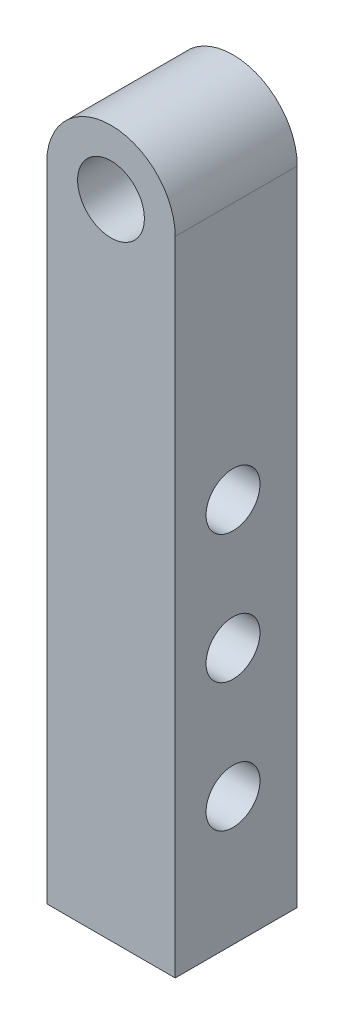
from build123d import *

# Parameters (mm, degrees)
SKETCH_1_R          = 2.6
EXTRUDE_1_DEPTH     = 9.5
SKETCH_2_R          = 2.1
CUT_EXTRUDE_1_DEPTH = 10


with BuildPart() as part:
    # 草图1 → 凸台-拉伸1 (new body)
    with BuildSketch(Plane.XY):
        with BuildLine():
            Line((-5, 0), (-5, -50))
            Line((-5, -50), (5, -50))
            Line((5, -50), (5, 0))
            ThreePointArc((5, 0), (0, 5), (-5, 0))
        make_face()
        Circle(SKETCH_1_R, mode=Mode.SUBTRACT)
    extrude(amount=EXTRUDE_1_DEPTH)

    # 草图2 → 切除-拉伸1 (cut)
    with BuildSketch(Plane.ZY.offset(5)):
        with Locations(Location((5, -20, 0), (0, 0, 270))):
            Circle(SKETCH_2_R)
        with Locations(Location((5, -30, 0), (0, 0, 270))):
            Circle(SKETCH_2_R)
        with Locations(Location((5, -40, 0), (0, 0, 270))):
            Circle(SKETCH_2_R)
    extrude(amount=-CUT_EXTRUDE_1_DEPTH, mode=Mode.SUBTRACT)


solid = part.part
